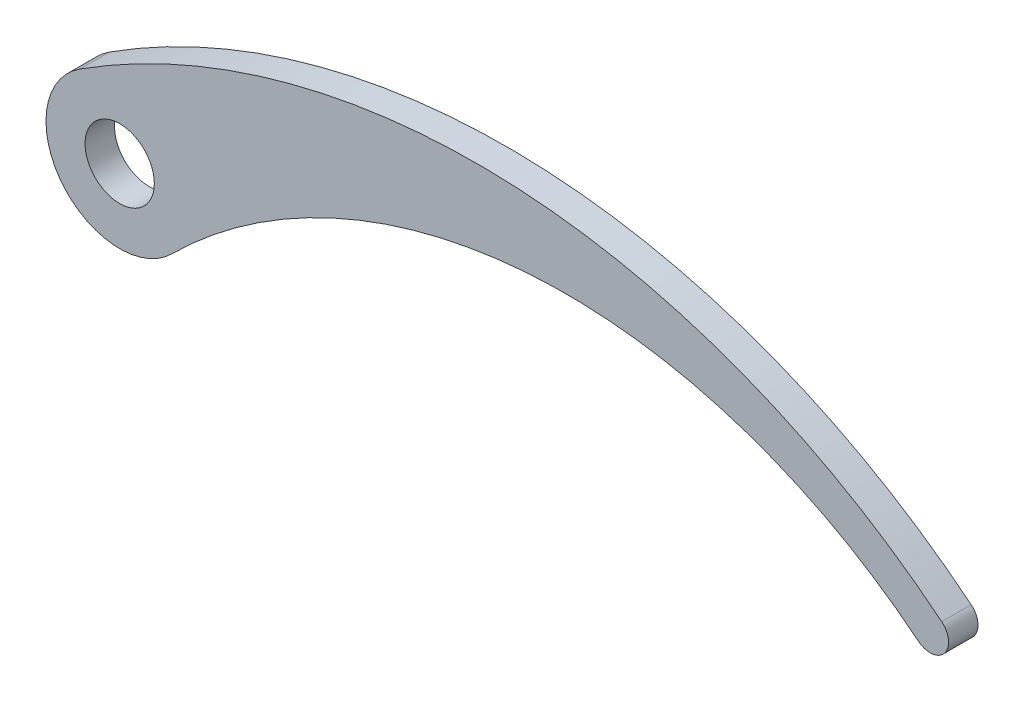
from build123d import *

# Parameters (mm, degrees)
SKETCH1_R           = 2.35
BOSS_EXTRUDE1_DEPTH = 2


with BuildPart() as part:
    # Sketch1 → Boss-Extrude1 (new body)
    with BuildSketch(Plane.XY):
        with BuildLine():
            ThreePointArc((-2.700441919, 4.208041521), (-3.899463546, -3.129566112), (3.523718288, -3.547310168))
            ThreePointArc((3.523718288, -3.547310168), (28.375530969, 7.444168044), (54.213502461, -0.971556288))
            ThreePointArc((54.213502461, -0.971556288), (55.97132144, -0.786787558), (55.787077506, 0.971086505))
            ThreePointArc((55.787077506, 0.971086505), (27.066967575, 12.05122679), (-2.700441919, 4.208041521))
        make_face()
        Circle(SKETCH1_R, mode=Mode.SUBTRACT)
    extrude(amount=BOSS_EXTRUDE1_DEPTH)


solid = part.part
